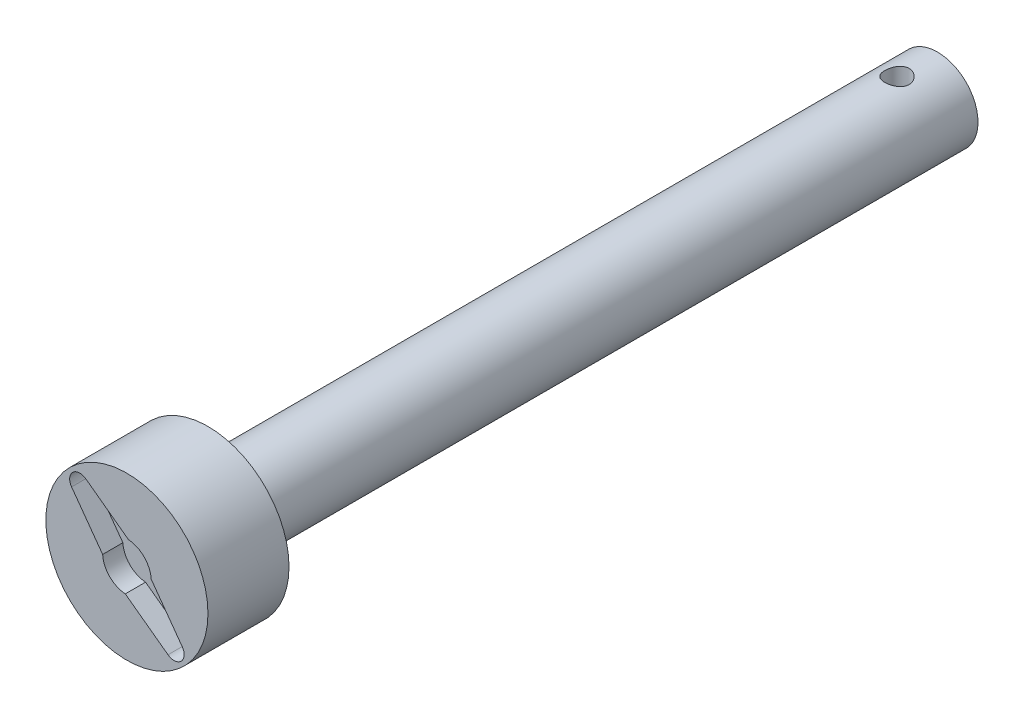
from build123d import *

# Parameters (mm, degrees)
SKETCH1_R               = 10
BOSS_EXTRUDE1_DEPTH     = 200
SKETCH2_R               = 20
BOSS_EXTRUDE2_DEPTH     = 20
SKETCH3_R               = 0.65
CUT_EXTRUDE1_DEPTH      = 5
SKETCH4_R               = 0.780836735
SKETCH4_R_2             = 0.65
CUT_EXTRUDE2_DEPTH      = 10
CUT_EXTRUDE3_DEPTH      = 202.990098767
CUT_EXTRUDE3_DEPTH_BACK = 202.990098767
SKETCH5_R               = 3


with BuildPart() as part:
    # Sketch1 → Boss-Extrude1 (new body)
    with BuildSketch(Plane.XY):
        Circle(SKETCH1_R)
    extrude(amount=BOSS_EXTRUDE1_DEPTH)

    # Sketch2 → Boss-Extrude2 (add)
    with BuildSketch(Plane.XY.offset(200)):
        Circle(SKETCH2_R)
    extrude(amount=-BOSS_EXTRUDE2_DEPTH)

    # Sketch3 → Cut-Extrude1 (cut)
    with BuildSketch(Plane.XY.offset(200)):
        with BuildLine():
            Line((0.398188886, 5.986772554), (-10.143967994, 13.726167778))
            ThreePointArc((-10.143967994, 13.726167778), (-13.384557042, 13.485311742), (-13.649708618, 10.246620085))
            Line((-13.649708618, 10.246620085), (-5.989590361, -0.353280782))
            ThreePointArc((-5.989590361, -0.353280782), (-4.258519498, -4.226702224), (-0.398188886, -5.986772554))
            Line((-0.398188886, -5.986772554), (10.143967994, -13.726167778))
            ThreePointArc((10.143967994, -13.726167778), (13.384557042, -13.485311742), (13.649708618, -10.246620085))
            Line((13.649708618, -10.246620085), (5.989590361, 0.353280782))
            ThreePointArc((5.989590361, 0.353280782), (4.258519498, 4.226702224), (0.398188886, 5.986772554))
        make_face()
        with Locations((11.623431116, -11.710928618)):
            Circle(SKETCH3_R, mode=Mode.SUBTRACT)
        with Locations((9.510080004, -9.581668869)):
            Circle(SKETCH3_R, mode=Mode.SUBTRACT)
        with Locations((-9.510080004, 9.581668869)):
            Circle(SKETCH3_R, mode=Mode.SUBTRACT)
        with Locations((-11.623431116, 11.710928618)):
            Circle(SKETCH3_R, mode=Mode.SUBTRACT)
    extrude(amount=-CUT_EXTRUDE1_DEPTH, mode=Mode.SUBTRACT)

    # Sketch4 → Cut-Extrude2 (cut)
    with BuildSketch(Plane.XY.offset(200)):
        with Locations((-9.510080004, 9.581668869)):
            Circle(SKETCH4_R)
        with Locations((-11.623431116, 11.710928618)):
            Circle(SKETCH4_R_2)
        with Locations((9.510080004, -9.581668869)):
            Circle(SKETCH4_R_2)
        with Locations((11.623431116, -11.710928618)):
            Circle(SKETCH4_R_2)
    extrude(amount=-CUT_EXTRUDE2_DEPTH, mode=Mode.SUBTRACT)

    # Sketch5 → Cut-Extrude3 (cut, two sides: drawn at the far end of the back side and taken through both)
    with BuildSketch(Plane(origin=(0, 0, 0), x_dir=(1, 0, 0), z_dir=(0, 1, 0)).offset(-CUT_EXTRUDE3_DEPTH_BACK)):
        with Locations(Location((0, -10, 0), (0, 0, 270))):
            Circle(SKETCH5_R)
    extrude(amount=CUT_EXTRUDE3_DEPTH + CUT_EXTRUDE3_DEPTH_BACK, mode=Mode.SUBTRACT)


solid = part.part
